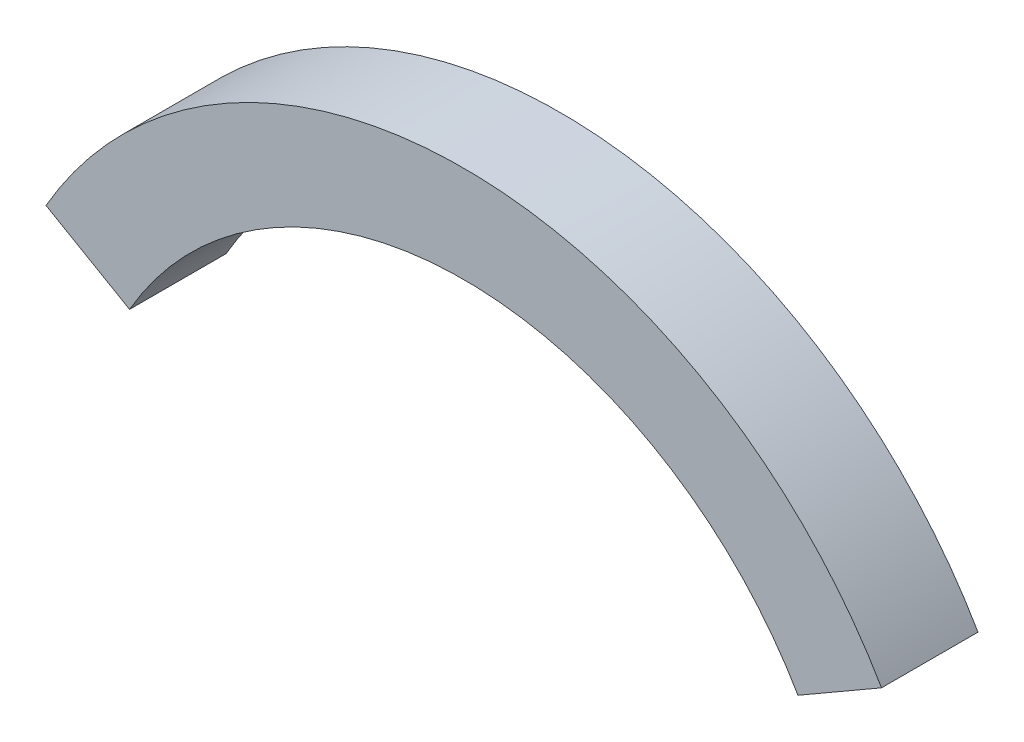
from build123d import *

# Parameters (mm, degrees)
EXTRUDE_1_DEPTH = 20


with BuildPart() as part:
    # 草图1 → 凸台-拉伸1 (new body)
    with BuildSketch(Plane.XY):
        with BuildLine():
            Line((0, 0), (17.320508076, -10))
            ThreePointArc((17.320508076, -10), (86.602540378, 30), (155.884572681, -10))
            Line((155.884572681, -10), (173.205080757, 0))
            ThreePointArc((173.205080757, 0), (86.602540378, 50), (0, 0))
        make_face()
    extrude(amount=EXTRUDE_1_DEPTH)


solid = part.part
